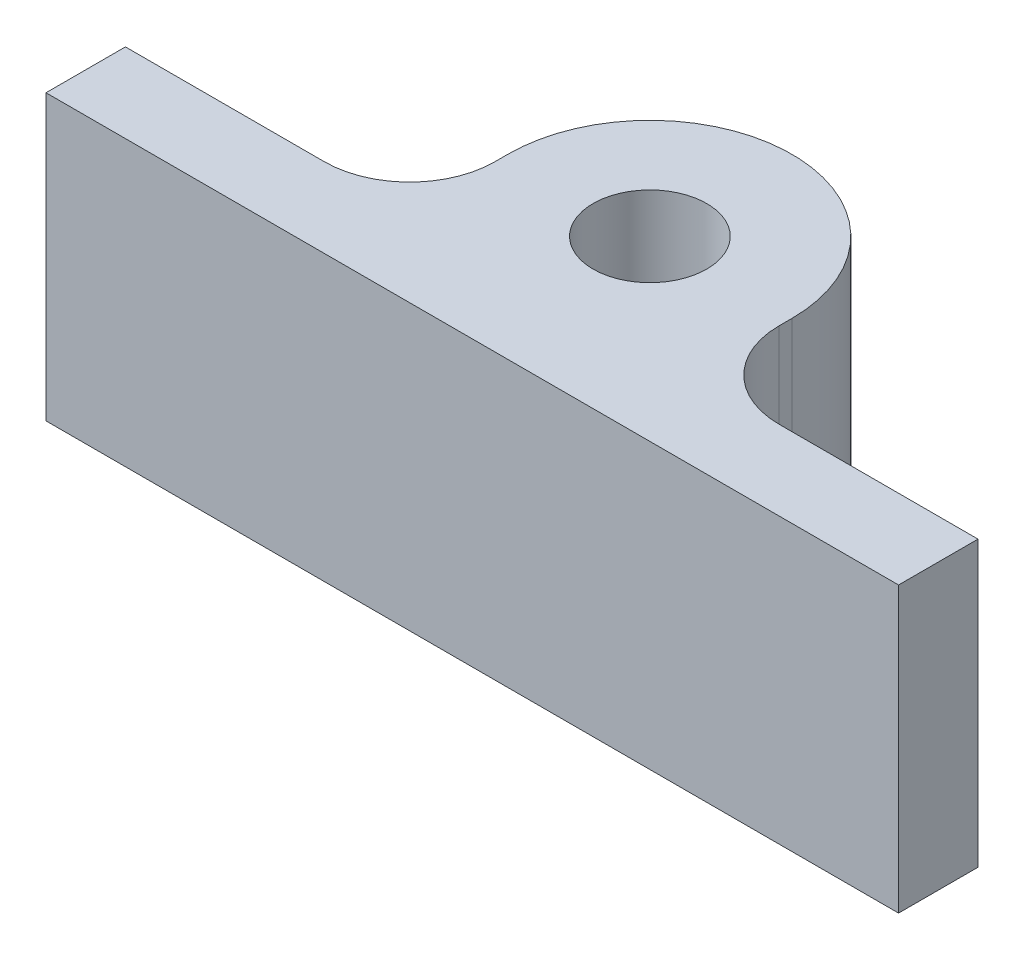
from build123d import *

# Parameters (mm, degrees)
SKETCH1_R           = 4
BOSS_EXTRUDE1_DEPTH = 20


with BuildPart() as part:
    # Sketch1 → Boss-Extrude1 (new body)
    with BuildSketch(Plane(origin=(0, 0, 0), x_dir=(1, 0, 0), z_dir=(0, 1, 0))):
        with BuildLine():
            Line((30, -12.5), (-30, -12.5))
            Line((-30, -12.5), (-30, -6.90963498))
            Line((-30, -6.90963498), (-16, -6.90963498))
            ThreePointArc((-16, -6.90963498), (-11.757359313, -5.152275667), (-10, -0.90963498))
            Line((-10, -0.90963498), (-10, 0))
            ThreePointArc((-10, 0), (0, 10), (10, 0))
            Line((10, 0), (10, -0.90963498))
            ThreePointArc((10, -0.90963498), (11.757359313, -5.152275667), (16, -6.90963498))
            Line((16, -6.90963498), (30, -6.90963498))
            Line((30, -6.90963498), (30, -12.5))
        make_face()
        with Locations(Location((0, 0, 0), (0, 0, 270))):
            Circle(SKETCH1_R, mode=Mode.SUBTRACT)
    extrude(amount=BOSS_EXTRUDE1_DEPTH)


solid = part.part
